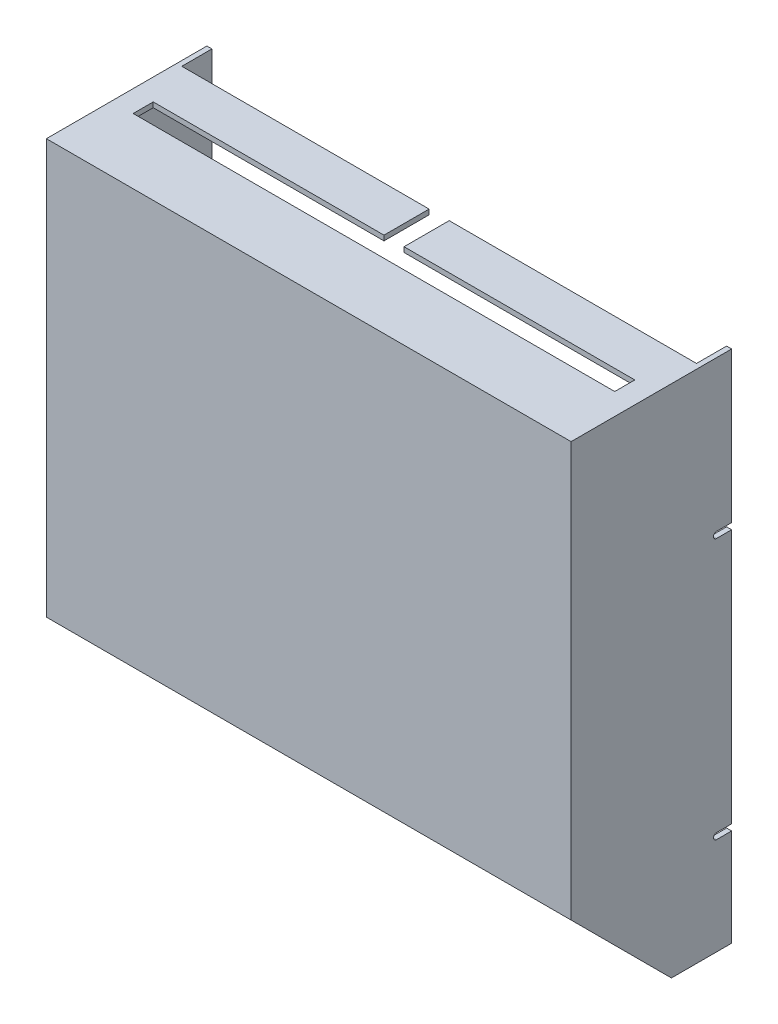
from build123d import *

# Parameters (mm, degrees)
SCHIZZO2_W                   = 523
SCHIZZO2_H                   = 513
ESTRUSIONE_ESTRUSIONE2_DEPTH = 130
SVUOTA1_T                    = -5
TAGLIO_ESTRUSIONE2_REACH     = 610.702
ESTRUSIONE_ESTRUSIONE3_DEPTH = 523
TAGLIO_ESTRUSIONE3_DEPTH     = 10
SCHIZZO5_W                   = 5
SCHIZZO5_H                   = 513
ESTRUSIONE_ESTRUSIONE5_DEPTH = 30
TAGLIO_ESTRUSIONE4_REACH     = 610.702


with BuildPart() as part:
    # Schizzo2 → Estrusione-Estrusione2 (new body)
    with BuildSketch(Plane.XY):
        with Locations((26.5, 26.5)):
            Rectangle(SCHIZZO2_W, SCHIZZO2_H)
    extrude(amount=ESTRUSIONE_ESTRUSIONE2_DEPTH)

    # Svuota1
    svuota1_openings = [part.faces().sort_by_distance(p)[0] for p in [
        (26.5, 26.5, 0),
    ]]
    offset(amount=SVUOTA1_T, openings=svuota1_openings, kind=Kind.INTERSECTION)

    # Taglio-Estrusione2: up to this face of the body (flat: up to its plane)
    taglio_estrusione2_end = Plane(part.part.faces().sort_by_distance((-235, 26.5, 65))[0])
    # Schizzo3 → Taglio-Estrusione2 (cut, up to the picked face)
    with BuildSketch(Plane(origin=(288, 0, 0), x_dir=(0, 0, -1), z_dir=(1, 0, 0)), mode=Mode.PRIVATE) as taglio_estrusione2_sk1:
        Polygon((-30, -230), (-130, -130), (-130, -230), align=None)
    taglio_estrusione2_tool1 = split(extrude(taglio_estrusione2_sk1.sketch, amount=-TAGLIO_ESTRUSIONE2_REACH, mode=Mode.PRIVATE), bisect_by=taglio_estrusione2_end, keep=Keep.BOTH, mode=Mode.PRIVATE)
    add(taglio_estrusione2_tool1.solids().sort_by(Axis((288, -196.666667, 96.666667), (-1, 0, 0)))[0], mode=Mode.SUBTRACT)

    # Schizzo3<4> → Estrusione-Estrusione3 (add)
    with BuildSketch(Plane(origin=(288, 0, 0), x_dir=(0, 0, -1), z_dir=(1, 0, 0))):
        Polygon((-130, -122.928932188), (-130, -130), (-30, -230), (-22.928932188, -230), align=None)
    extrude(amount=-ESTRUSIONE_ESTRUSIONE3_DEPTH)

    # Schizzo4 → Taglio-Estrusione3 (cut)
    with BuildSketch(Plane(origin=(0, 283, 0), x_dir=(1, 0, 0), z_dir=(0, 1, 0))):
        Polygon((-213.5, -65), (266.5, -65), (266.5, -45), (36.5, -45), (36.5, 0), (16.5, 0), (16.5, -45), (-213.5, -45), align=None)
    extrude(amount=-TAGLIO_ESTRUSIONE3_DEPTH, mode=Mode.SUBTRACT)

    # Schizzo5 → Estrusione-Estrusione5 (add)
    with BuildSketch(Plane.XY):
        with Locations((285.5, 26.5)):
            Rectangle(SCHIZZO5_W, SCHIZZO5_H)
        with Locations((-232.5, 26.5)):
            Rectangle(SCHIZZO5_W, SCHIZZO5_H)
    extrude(amount=-ESTRUSIONE_ESTRUSIONE5_DEPTH)

    # Taglio-Estrusione4: up to this face of the body (flat: up to its plane)
    taglio_estrusione4_end = Plane(part.part.faces().sort_by_distance((288, 40.976301678, 46.972842069))[0])
    # Schizzo6 → Taglio-Estrusione4 (cut, up to the picked face)
    with BuildSketch(Plane.ZY.offset(235), mode=Mode.PRIVATE) as taglio_estrusione4_sk1:
        with BuildLine():
            Line((-15, 133.05), (-30, 133.05))
            Line((-30, 133.05), (-30, 126.95))
            Line((-30, 126.95), (-15, 126.95))
            ThreePointArc((-15, 126.95), (-11.95, 130), (-15, 133.05))
        make_face()
    taglio_estrusione4_tool1 = split(extrude(taglio_estrusione4_sk1.sketch, amount=-TAGLIO_ESTRUSIONE4_REACH, mode=Mode.PRIVATE), bisect_by=taglio_estrusione4_end, keep=Keep.BOTH, mode=Mode.PRIVATE)
    # Schizzo6 → Taglio-Estrusione4 (cut, up to the picked face)
    with BuildSketch(Plane.ZY.offset(235), mode=Mode.PRIVATE) as taglio_estrusione4_sk2:
        with BuildLine():
            Line((-30, -133.05), (-30, -126.95))
            Line((-30, -126.95), (-15, -126.95))
            ThreePointArc((-15, -126.95), (-11.95, -130), (-15, -133.05))
            Line((-15, -133.05), (-30, -133.05))
        make_face()
    taglio_estrusione4_tool2 = split(extrude(taglio_estrusione4_sk2.sketch, amount=-TAGLIO_ESTRUSIONE4_REACH, mode=Mode.PRIVATE), bisect_by=taglio_estrusione4_end, keep=Keep.BOTH, mode=Mode.PRIVATE)
    add(taglio_estrusione4_tool1.solids().sort_by(Axis((-235, 130, -21.288948), (1, 0, 0)))[0], mode=Mode.SUBTRACT)
    add(taglio_estrusione4_tool2.solids().sort_by(Axis((-235, -130, -21.288948), (1, 0, 0)))[0], mode=Mode.SUBTRACT)


solid = part.part
